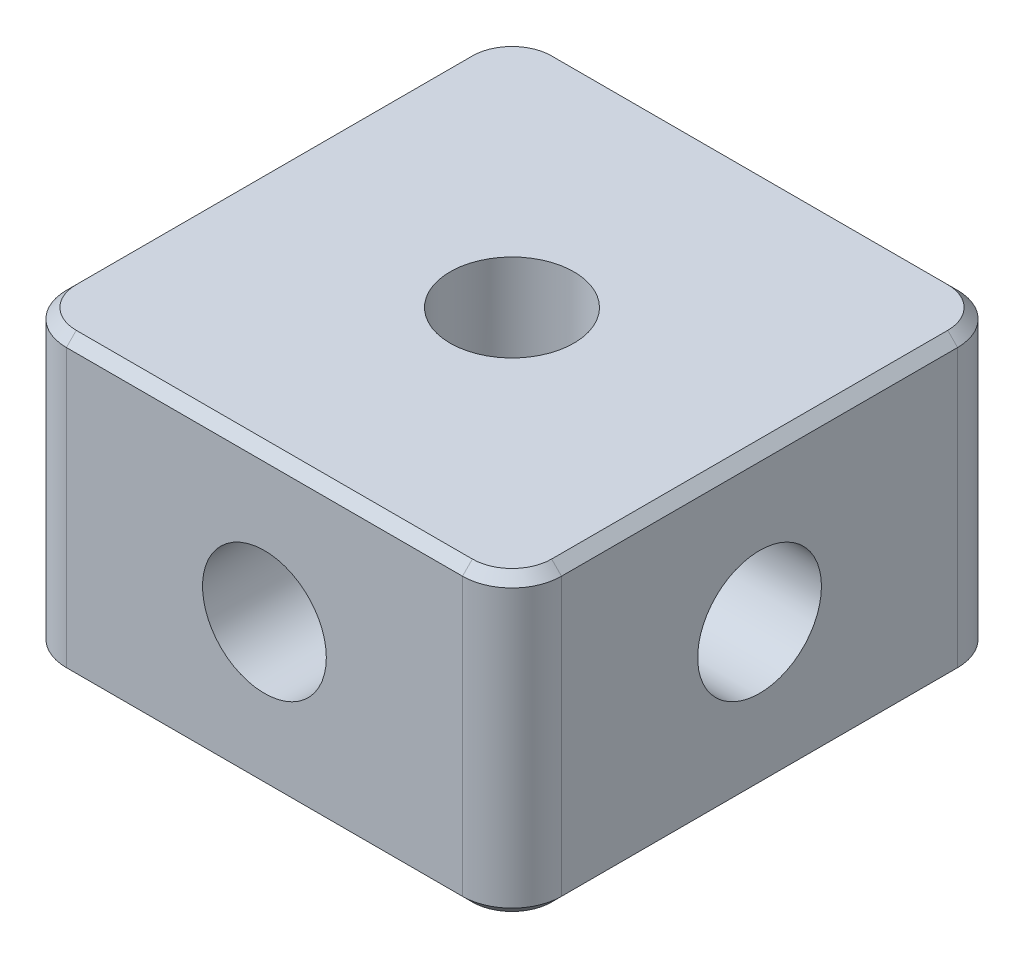
from build123d import *

# Parameters (mm, degrees)
SKETCH_1_W         = 10
SKETCH_1_H         = 10
EXTRUDE_1_DEPTH    = 3
HOLE_WIZARD_M3_1_D = 2.5
HOLE_WIZARD_M3_2_D = 2.5
HOLE_WIZARD_M3_3_D = 2.5
FILLET_1_R         = 1
CHAMFER_1_SIZE     = 0.2


with BuildPart() as part:
    # 草图1 → 凸台-拉伸1 (new, symmetric)
    with BuildSketch(Plane(origin=(0, 0, 0), x_dir=(1, 0, 0), z_dir=(0, 1, 0))):
        Rectangle(SKETCH_1_W, SKETCH_1_H)
    extrude(amount=EXTRUDE_1_DEPTH, both=True)

    # M3 螺纹孔1 (through all)
    with Locations(Plane(origin=(0, 3, 0), x_dir=(1, 0, 0), z_dir=(0, 1, 0))):
        with Locations((0, 0)):
            Hole(HOLE_WIZARD_M3_1_D / 2)

    # M3 螺纹孔2 (through all)
    with Locations(Plane.XY.offset(5)):
        with Locations((0, 0)):
            Hole(HOLE_WIZARD_M3_2_D / 2)

    # M3 螺纹孔3 (through all)
    with Locations(Plane(origin=(5, 0, 0), x_dir=(0, 0, -1), z_dir=(1, 0, 0))):
        with Locations((0, 0)):
            Hole(HOLE_WIZARD_M3_3_D / 2)

    # 圆角1
    fillet_1_edges = [part.edges().sort_by_distance(p)[0] for p in [
        (5, 0, 5),
        (-5, 0, 5),
        (-5, 0, -5),
        (5, 0, -5),
    ]]
    fillet(fillet_1_edges, radius=FILLET_1_R)

    # 倒角1
    chamfer_1_edges = [part.edges().sort_by_distance(p)[0] for p in [
        (0, -3, -5),
        (0, 3, -5),
        (5, -3, 0),
        (0, -3, 5),
        (-5, -3, 0),
        (-4.707106781, -3, -4.707106781),
        (-4.707106781, -3, 4.707106781),
        (4.707106781, -3, 4.707106781),
        (4.707106781, -3, -4.707106781),
        (5, 3, 0),
        (-5, 3, 0),
        (0, 3, 5),
        (-4.707106781, 3, -4.707106781),
        (-4.707106781, 3, 4.707106781),
        (4.707106781, 3, 4.707106781),
        (4.707106781, 3, -4.707106781),
    ]]
    chamfer(chamfer_1_edges, length=CHAMFER_1_SIZE)


solid = part.part
